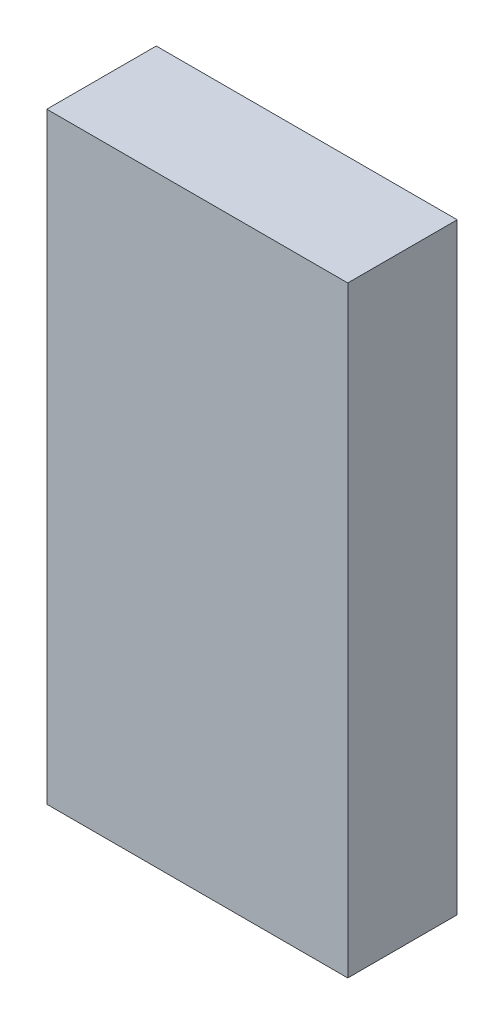
from build123d import *

# Parameters (mm, degrees)
SKETCH_1_W      = 110
SKETCH_1_H      = 220
EXTRUDE_1_DEPTH = 40


with BuildPart() as part:
    # ｽｹｯﾁ1 → ﾎﾞｽ - 押し出し1 (new body)
    with BuildSketch(Plane.XY):
        Rectangle(SKETCH_1_W, SKETCH_1_H)
    extrude(amount=EXTRUDE_1_DEPTH)


solid = part.part
